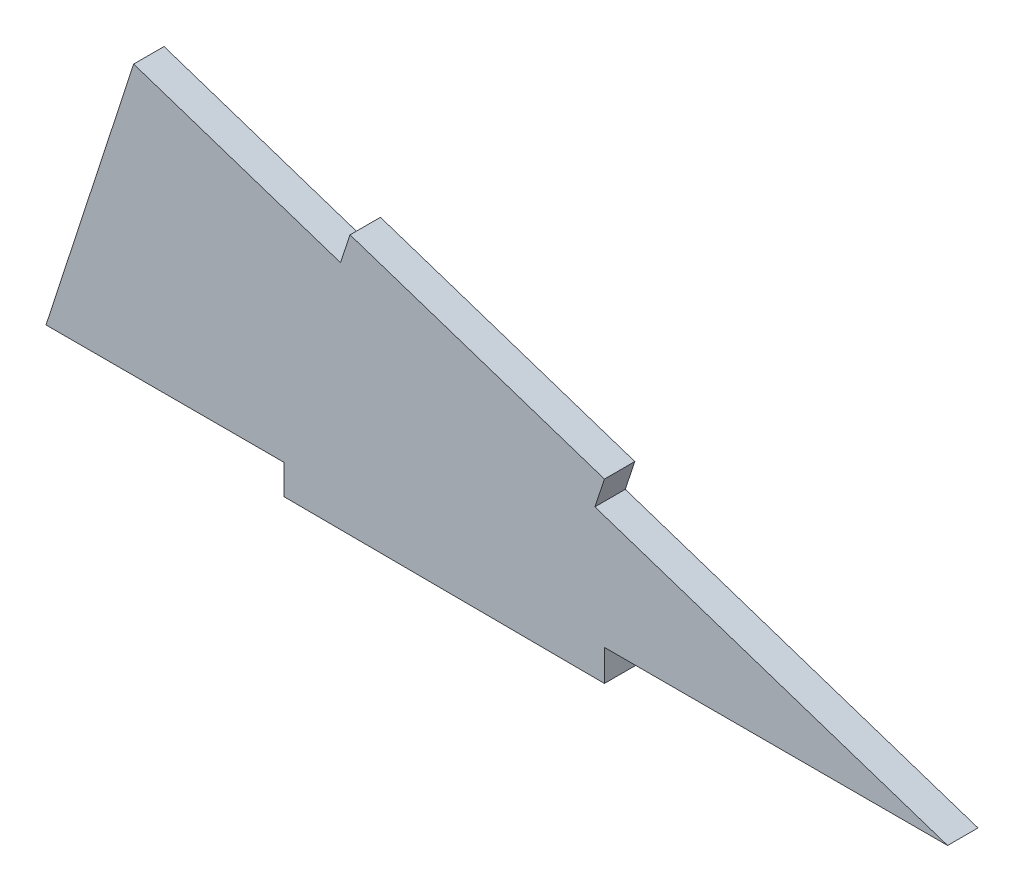
from build123d import *

# Parameters (mm, degrees)
BOSS_EXTRUDE1_DEPTH = 3
BOSS_EXTRUDE2_DEPTH = 3


with BuildPart() as part:
    # Sketch1 → Boss-Extrude1 (new body)
    with BuildSketch(Plane.XY):
        Polygon((0, 0), (-89, 0), (-80.347524158, 26.629582456), align=None)
    extrude(amount=BOSS_EXTRUDE1_DEPTH)

    # Sketch3 → Boss-Extrude2 (add)
    with BuildSketch(Plane.XY.offset(3)):
        Polygon((-65.527189586, 0), (-65.527189586, -2.933860522), (-33.874345064, -3.087202401), (-33.874345064, 0), align=None)
        Polygon((-59.931116708, 19.862971894), (-58.987312784, 22.710643601), (-33.874345064, 14.38745192), (-34.818148987, 11.539780213), align=None)
    extrude(amount=-BOSS_EXTRUDE2_DEPTH)


solid = part.part
